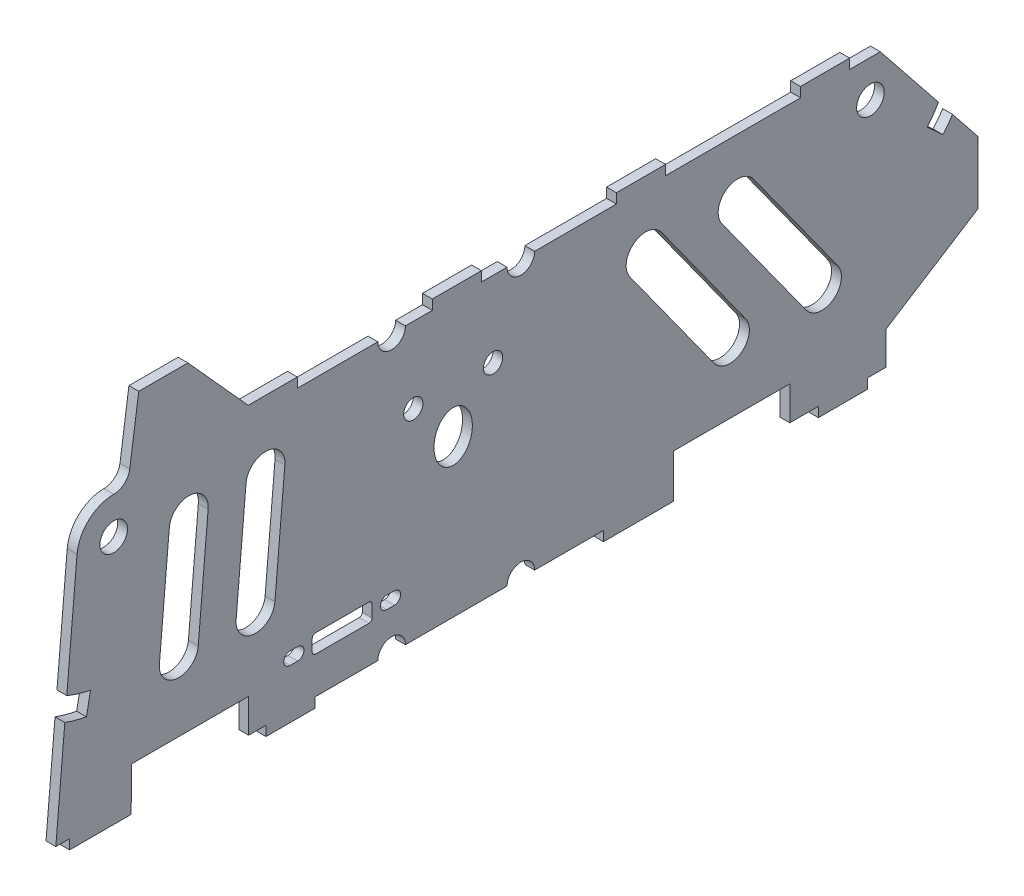
from build123d import *

# Parameters (mm, degrees)
SKETCH_218_R           = 2.25
EXTRUDE_1_DEPTH        = 1.6
SKETCH_2_W             = 8
SKETCH_2_H             = 1.6
EXTRUDE_3412_DEPTH     = 1.6
SKETCH2_W              = 19.07286805
SKETCH2_H              = 5.5
SKETCH2_H_2            = 5.238743847
SKETCH2_W_2            = 18.956012289
SKETCH2_H_3            = 4.1
CUT_EXTRUDE_4293_DEPTH = 113.482438083
SKETCH_4339_R          = 1.575
SKETCH_4339_RX         = 4.079397779
SKETCH_4339_RY         = 3.125
CUT_EXTRUDE_4732_DEPTH = 113.482438083
CUT_EXTRUDE_5198_DEPTH = 113.482438221
USB_C_DEPTH            = 113.482438221
BOSS_EXTRUDE1_DEPTH    = 1.6


with BuildPart() as part:
    # Sketch 218 → 凸台-拉伸1 (new body)
    with BuildSketch(Plane(origin=(0, 0, 0), x_dir=(0, 0, -1), z_dir=(1, 0, 0))):
        with BuildLine():
            Line((-95.193976275, 16.776432698), (-96.66172395, 0))
            Line((-96.66172395, 0), (-44.182229478, 0))
            ThreePointArc((-44.182229478, 0), (-41.932229478, 2.25), (-39.682229478, 0))
            Line((-39.682229478, 0), (-23.132229478, 0))
            ThreePointArc((-23.132229478, 0), (-20.882229478, 2.25), (-18.632229478, 0))
            Line((-18.632229478, 0), (38.58827605, 0))
            Line((38.58827605, 0), (38.58827605, 5.363667343))
            Line((38.58827605, 5.363667343), (53.613979238, 14.877821069))
            Line((53.613979238, 14.877821069), (53.613979238, 25.082386187))
            Line((53.613979238, 25.082386187), (49.47062371, 30.265958003))
            ThreePointArc((49.47062371, 30.265958003), (48.71615842, 29.206772475), (47.878069959, 28.212438733))
            Line((47.878069959, 28.212438733), (45.32875497, 30.545040291))
            ThreePointArc((45.32875497, 30.545040291), (46.329625978, 31.78976103), (47.163951689, 33.151735001))
            Line((47.163951689, 33.151735001), (38.58827605, 43.88038965))
            Line((38.58827605, 43.88038965), (37.693344157, 45))
            Line((37.693344157, 45), (-18.632229478, 45))
            ThreePointArc((-18.632229478, 45), (-20.882229478, 42.75), (-23.132229478, 45))
            Line((-23.132229478, 45), (-39.682229478, 45))
            ThreePointArc((-39.682229478, 45), (-41.932229478, 42.75), (-44.182229478, 45))
            Line((-44.182229478, 45), (-87.226747047, 45))
            ThreePointArc((-87.226747047, 45), (-91.280288293, 43.423664021), (-93.203915236, 39.522934456))
            Line((-93.203915236, 39.522934456), (-94.87665585, 20.403421746))
            ThreePointArc((-94.87665585, 20.403421746), (-92.972963578, 19.729950103), (-91.011324976, 19.250802615))
            Line((-91.011324976, 19.250802615), (-91.670050843, 15.813350036))
            ThreePointArc((-91.670050843, 15.813350036), (-93.450669808, 16.226628035), (-95.193976275, 16.776432698))
        make_face()
        with Locations((-87.226747047, 39)):
            Circle(SKETCH_218_R, mode=Mode.SUBTRACT)
        with Locations((36.08827605, 39)):
            Circle(SKETCH_218_R, mode=Mode.SUBTRACT)
    extrude(amount=EXTRUDE_1_DEPTH)

    # 草图2 → Extrude 3412 (add)
    with BuildSketch(Plane(origin=(0, 0, 0), x_dir=(0, 0, -1), z_dir=(1, 0, 0))):
        with Locations((31.58827605, -0.8)):
            Rectangle(SKETCH_2_W, SKETCH_2_H)
        with BuildLine():
            Line((-83.150237988, 57.5), (-84.607683433, 47.272305319))
            ThreePointArc((-84.607683433, 47.272305319), (-85.493046837, 45.647255317), (-87.226747047, 45))
            Line((-87.226747047, 45), (-65.306655843, 45))
            Line((-65.306655843, 45), (-57.306655843, 45))
            Line((-57.306655843, 45), (-57.306655843, 46.6))
            Line((-57.306655843, 46.6), (-65.306655843, 46.6))
            Line((-65.306655843, 46.6), (-75.139107316, 57.5))
            Line((-75.139107316, 57.5), (-83.150237988, 57.5))
        make_face()
        with Locations((1.58827605, -0.8)):
            Rectangle(SKETCH_2_W, SKETCH_2_H)
        with Locations((-58.41172395, -0.8)):
            Rectangle(SKETCH_2_W, SKETCH_2_H)
        with Locations((-88.41172395, -0.8)):
            Rectangle(SKETCH_2_W, SKETCH_2_H)
        with Locations((28.693344157, 45.8)):
            Rectangle(SKETCH_2_W, SKETCH_2_H)
        with Locations((-1.306655843, 45.8)):
            Rectangle(SKETCH_2_W, SKETCH_2_H)
        with Locations((-31.306655843, 45.8)):
            Rectangle(SKETCH_2_W, SKETCH_2_H)
    extrude(amount=EXTRUDE_3412_DEPTH)

    # Sketch2 → Cut-Extrude 4293 (cut, through all)
    with BuildSketch(Plane(origin=(1.6, 0, 0), x_dir=(0, 0, -1), z_dir=(1, 0, 0))):
        with Locations((-74.777688237, 2.75)):
            Rectangle(SKETCH2_W, SKETCH2_H)
        with Locations((-74.777688237, -2.619371924)):
            Rectangle(SKETCH2_W, SKETCH2_H_2)
        with Locations((13.467678305, 2.75)):
            Rectangle(SKETCH2_W_2, SKETCH2_H)
        with Locations((13.467678305, -2.05)):
            Rectangle(SKETCH2_W_2, SKETCH2_H_3)
    extrude(amount=-CUT_EXTRUDE_4293_DEPTH, mode=Mode.SUBTRACT)

    # Sketch 4339 → Cut-Extrude 4732 (cut, through all)
    with BuildSketch(Plane(origin=(1.6, 0, 0), x_dir=(0, 0, -1), z_dir=(1, 0, 0))):
        with Locations((-38.41172395, 32.651369249)):
            Circle(SKETCH_4339_R)
        with Locations((-25.41172395, 32.651369249)):
            Circle(SKETCH_4339_R)
        with Locations(Location((-31.91172395, 25.5), (0, 0, 90))):
            Ellipse(SKETCH_4339_RX, SKETCH_4339_RY)
    extrude(amount=-CUT_EXTRUDE_4732_DEPTH, mode=Mode.SUBTRACT)

    # 草图3 → Cut-Extrude 5198 (cut, through all)
    with BuildSketch(Plane(origin=(1.6, 0, 0), x_dir=(0, 0, -1), z_dir=(1, 0, 0))):
        with BuildLine():
            Line((-71.837081834, 35.223280517), (-73.455622109, 16.723280517))
            ThreePointArc((-73.455622109, 16.723280517), (-76.895259758, 13.837081834), (-79.781458442, 17.276719483))
            Line((-79.781458442, 17.276719483), (-78.162918166, 35.776719483))
            ThreePointArc((-78.162918166, 35.776719483), (-74.723280517, 38.662918166), (-71.837081834, 35.223280517))
        make_face()
        with BuildLine():
            Line((17.026747393, 37.354992688), (30.756614535, 18.283004112))
            ThreePointArc((30.756614535, 18.283004112), (30.034859831, 13.851264031), (25.60311975, 14.573018735))
            Line((25.60311975, 14.573018735), (11.873252607, 33.645007312))
            ThreePointArc((11.873252607, 33.645007312), (12.595007312, 38.076747393), (17.026747393, 37.354992688))
        make_face()
        with BuildLine():
            Line((2.026747393, 37.354992688), (15.756614535, 18.283004112))
            ThreePointArc((15.756614535, 18.283004112), (15.034859831, 13.851264031), (10.60311975, 14.573018735))
            Line((10.60311975, 14.573018735), (-3.126747393, 33.645007312))
            ThreePointArc((-3.126747393, 33.645007312), (-2.404992688, 38.076747393), (2.026747393, 37.354992688))
        make_face()
        with BuildLine():
            Line((-59.337081834, 35.223280517), (-60.955622109, 16.723280517))
            ThreePointArc((-60.955622109, 16.723280517), (-64.395259758, 13.837081834), (-67.281458442, 17.276719483))
            Line((-67.281458442, 17.276719483), (-65.662918166, 35.776719483))
            ThreePointArc((-65.662918166, 35.776719483), (-62.223280517, 38.662918166), (-59.337081834, 35.223280517))
        make_face()
    extrude(amount=-CUT_EXTRUDE_5198_DEPTH, mode=Mode.SUBTRACT)

    # Sketch1 → USB-C供电接口 (cut, through all)
    with BuildSketch(Plane(origin=(0, 0, 0), x_dir=(0, 0, -1), z_dir=(1, 0, 0))):
        with BuildLine():
            Line((-54.375, 9), (-45.625, 9))
            ThreePointArc((-45.625, 9), (-45.271446609, 8.853553391), (-45.125, 8.5))
            Line((-45.125, 8.5), (-45.125, 6.5))
            ThreePointArc((-45.125, 6.5), (-45.271446609, 6.146446609), (-45.625, 6))
            Line((-45.625, 6), (-54.375, 6))
            ThreePointArc((-54.375, 6), (-54.728553391, 6.146446609), (-54.875, 6.5))
            Line((-54.875, 6.5), (-54.875, 8.5))
            ThreePointArc((-54.875, 8.5), (-54.728553391, 8.853553391), (-54.375, 9))
        make_face()
        with BuildLine():
            Line((-57.25, 6.475), (-58.5, 6.475))
            ThreePointArc((-58.5, 6.475), (-59.525, 7.5), (-58.5, 8.525))
            Line((-58.5, 8.525), (-57.25, 8.525))
            ThreePointArc((-57.25, 8.525), (-56.225, 7.5), (-57.25, 6.475))
        make_face()
        with BuildLine():
            Line((-42.75, 6.475), (-41.5, 6.475))
            ThreePointArc((-41.5, 6.475), (-40.475, 7.5), (-41.5, 8.525))
            Line((-41.5, 8.525), (-42.75, 8.525))
            ThreePointArc((-42.75, 8.525), (-43.775, 7.5), (-42.75, 6.475))
        make_face()
    extrude(amount=USB_C_DEPTH, mode=Mode.SUBTRACT)

    # Sketch3 → Boss-Extrude1 (add)
    with BuildSketch(Plane(origin=(1.6, 0, 0), x_dir=(0, 0, -1), z_dir=(1, 0, 0))):
        Polygon((-92.41172395, -1.6), (-94.41172395, -1.6), (-94.41172395, 0), (-94.41172395, 0.25), (-92.16172395, 0.25), (-92.16172395, -1.6), align=None)
        Polygon((-2.41172395, -1.6), (-7.41172395, -1.6), (-7.41172395, 0), (-7.41172395, 0.25), (-2.16172395, 0.25), (-2.16172395, -1.6), align=None)
    extrude(amount=-BOSS_EXTRUDE1_DEPTH)


solid = part.part
